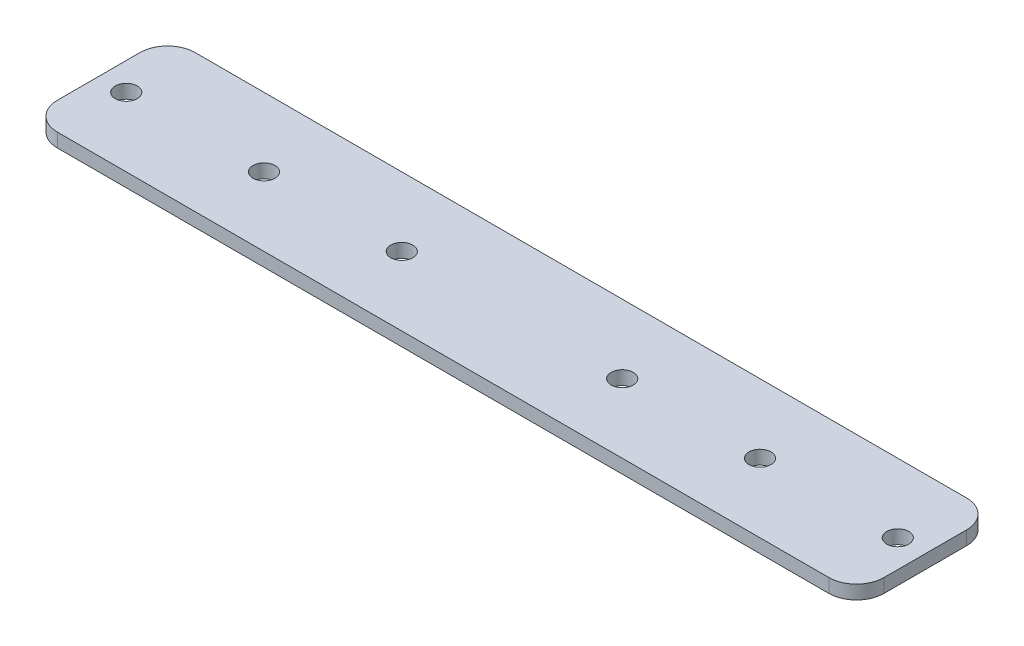
from build123d import *

# Parameters (mm, degrees)
SKETCH_1_W      = 120
SKETCH_1_H      = 20
SKETCH_1_R      = 1.6
EXTRUDE_1_DEPTH = 2
FILLET_1_R      = 4


with BuildPart() as part:
    # 草图1 → 凸台-拉伸1 (new body)
    with BuildSketch(Plane(origin=(0, 0, 0), x_dir=(1, 0, 0), z_dir=(0, 1, 0))):
        Rectangle(SKETCH_1_W, SKETCH_1_H)
        with Locations(Location((16, 0, 0), (0, 0, 270))):
            Circle(SKETCH_1_R, mode=Mode.SUBTRACT)
        with Locations(Location((-16, 0, 0), (0, 0, 270))):
            Circle(SKETCH_1_R, mode=Mode.SUBTRACT)
        with Locations(Location((36, 0, 0), (0, 0, 270))):
            Circle(SKETCH_1_R, mode=Mode.SUBTRACT)
        with Locations(Location((56, 0, 0), (0, 0, 270))):
            Circle(SKETCH_1_R, mode=Mode.SUBTRACT)
        with Locations(Location((-36, 0, 0), (0, 0, 270))):
            Circle(SKETCH_1_R, mode=Mode.SUBTRACT)
        with Locations(Location((-56, 0, 0), (0, 0, 270))):
            Circle(SKETCH_1_R, mode=Mode.SUBTRACT)
    extrude(amount=EXTRUDE_1_DEPTH)

    # 圆角1
    fillet_1_edges = [part.edges().sort_by_distance(p)[0] for p in [
        (60, 1, 10),
        (-60, 1, 10),
        (-60, 1, -10),
        (60, 1, -10),
    ]]
    fillet(fillet_1_edges, radius=FILLET_1_R)


solid = part.part
